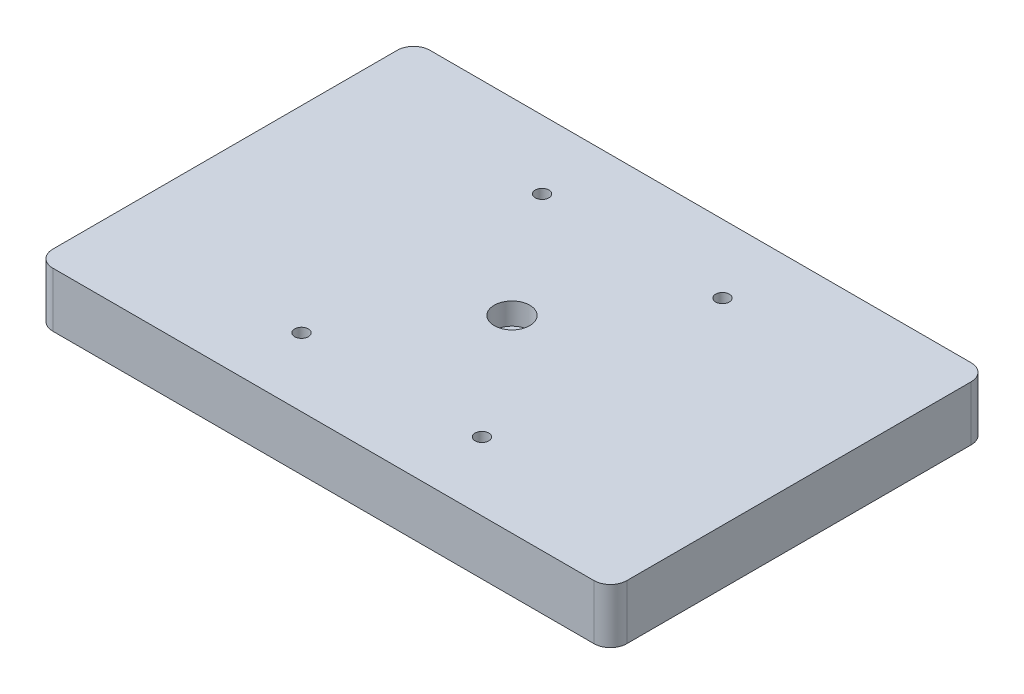
from build123d import *

# Parameters (mm, degrees)
SKETCH1_W                      = 105
SKETCH1_H                      = 69
BOSS_EXTRUDE1_DEPTH            = 10
FILLET1_R                      = 3
CBORE_FOR_M3_SHCS1_D           = 3.4
CBORE_FOR_M3_SHCS1_CBORE_D     = 6.5
CBORE_FOR_M3_SHCS1_CBORE_DEPTH = 4


with BuildPart() as part:
    # Sketch1 → Boss-Extrude1 (new body)
    with BuildSketch(Plane(origin=(0, 0, 0), x_dir=(1, 0, 0), z_dir=(0, 1, 0))):
        Rectangle(SKETCH1_W, SKETCH1_H)
    extrude(amount=BOSS_EXTRUDE1_DEPTH)

    # Fillet1
    fillet1_edges = [part.edges().sort_by_distance(p)[0] for p in [
        (52.5, 5, 34.5),
        (-52.5, 5, 34.5),
        (-52.5, 5, -34.5),
        (52.5, 5, -34.5),
    ]]
    fillet(fillet1_edges, radius=FILLET1_R)

    # CBORE for M3 SHCS1 (through all)
    with Locations(Plane(origin=(0, 10, 0), x_dir=(1, 0, 0), z_dir=(0, 1, 0))):
        with Locations((0, 0)):
            CounterBoreHole(CBORE_FOR_M3_SHCS1_D / 2, CBORE_FOR_M3_SHCS1_CBORE_D / 2, CBORE_FOR_M3_SHCS1_CBORE_DEPTH)

    # Sketch5 → M3x0.5 Tapped Hole1 (revolve, cut)
    with BuildSketch(Plane(origin=(16.5, 10, 22), x_dir=(0, 0, 1), z_dir=(1, 0, 0))):
        Polygon((0, 0), (0, 10.751075774), (1.25, 10), (1.25, 0), align=None)
    m3x0_5_tapped_hole1 = revolve(axis=Axis((16.5, 16.35, 22), (0, -1, 0)), mode=Mode.SUBTRACT)

    # Mirror1: M3x0.5 Tapped Hole1 across plane
    add(m3x0_5_tapped_hole1.mirror(Plane(origin=(0, 0, 0), x_dir=(0, 0, 1), z_dir=(1, 0, 0))), mode=Mode.SUBTRACT)

    # Mirror2: M3x0.5 Tapped Hole1 across plane
    add(m3x0_5_tapped_hole1.mirror(Plane.XY), mode=Mode.SUBTRACT)

    # Mirror2 copy 1 sketch → Mirror2 copy 1 (revolve, cut)
    with BuildSketch(Plane(origin=(-16.5, 10, -22), x_dir=(0, 0, -1), z_dir=(-1, 0, 0))):
        Polygon((0, 0), (0, 10.751075774), (1.25, 10), (1.25, 0), align=None)
    revolve(axis=Axis((-16.5, 16.35, -22), (0, -1, 0)), mode=Mode.SUBTRACT)


solid = part.part
